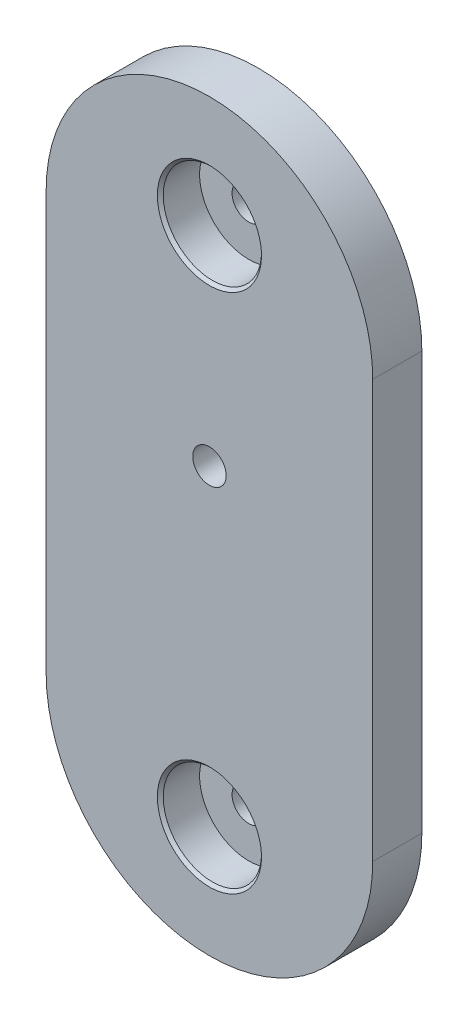
from build123d import *

# Parameters (mm, degrees)
SKETCH1_R           = 1.7
BOSS_EXTRUDE1_DEPTH = 5
SKETCH3_R           = 5
CUT_EXTRUDE1_DEPTH  = 4
CHAMFER1_SIZE       = 0.3


with BuildPart() as part:
    # Sketch1 → Boss-Extrude1 (new body)
    with BuildSketch(Plane.XY):
        with BuildLine():
            Line((-16.6225, -21.2525), (-16.6225, 21.2525))
            ThreePointArc((-16.6225, 21.2525), (0, 37.875), (16.6225, 21.2525))
            Line((16.6225, 21.2525), (16.6225, -21.2525))
            ThreePointArc((16.6225, -21.2525), (0, -37.875), (-16.6225, -21.2525))
        make_face()
        with Locations((0, 26.5125)):
            Circle(SKETCH1_R, mode=Mode.SUBTRACT)
        with Locations((0, -26.5125)):
            Circle(SKETCH1_R, mode=Mode.SUBTRACT)
    extrude(amount=BOSS_EXTRUDE1_DEPTH)

    # Sketch3 → Cut-Extrude1 (cut)
    with BuildSketch(Plane.XY.offset(5)):
        with Locations((0, 26.5125)):
            Circle(SKETCH3_R)
        with Locations((0, -26.5125)):
            Circle(SKETCH3_R)
    extrude(amount=-CUT_EXTRUDE1_DEPTH, mode=Mode.SUBTRACT)

    # Sketch2 → Cut-Revolve1 (revolve, cut)
    with BuildSketch(Plane(origin=(0, 0, 0), x_dir=(0, 0, -1), z_dir=(1, 0, 0)), mode=Mode.PRIVATE) as cut_revolve1_sk:
        Polygon((-5, 5.3025), (0, 5.3025), (0, 2.3025), (-1.3, 3.6025), (-5, 3.6025), align=None)
    revolve(cut_revolve1_sk.sketch.rotate(Axis((0, 5.3025, 13.61294397), (0, 0, -1)), 270), axis=Axis((0, 5.3025, 13.61294397), (0, 0, -1)), mode=Mode.SUBTRACT)

    # Chamfer1
    chamfer1_edges = [part.edges().sort_by_distance(p)[0] for p in [
        (-5, 26.5125, 5),
        (-5, -26.5125, 5),
    ]]
    chamfer(chamfer1_edges, length=CHAMFER1_SIZE)


solid = part.part
